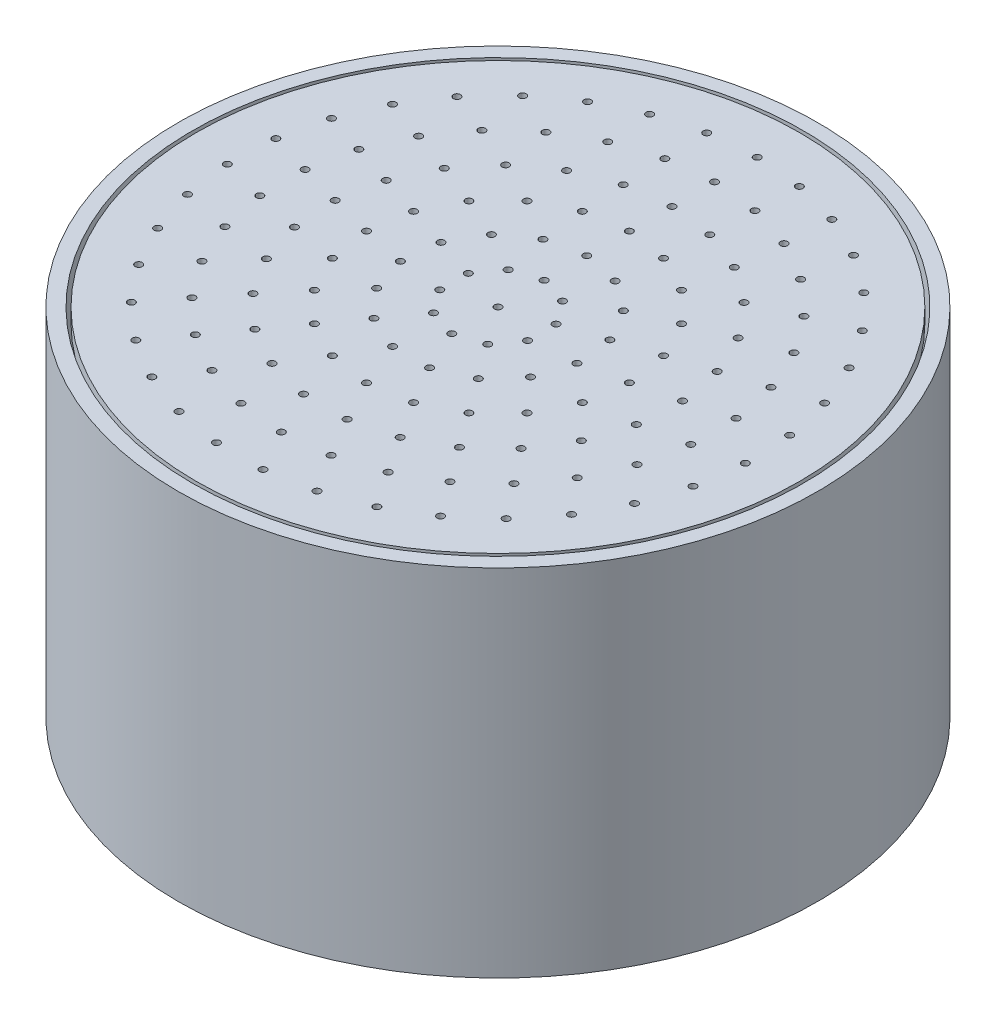
from build123d import *

# Parameters (mm, degrees)
SKETCH1_R            = 225
SKETCH1_R_2          = 215
BOSS_EXTRUDE1_DEPTH  = 250
SKETCH2_R            = 212.5
SKETCH2_R_2          = 2.5
BOSS_EXTRUDE13_DEPTH = 10
SKETCH4_R            = 212.5
SKETCH4_R_2          = 2.5
BOSS_EXTRUDE14_DEPTH = 10


with BuildPart() as part:
    # Sketch1 → Boss-Extrude1 (new body)
    with BuildSketch(Plane(origin=(0, 0, 0), x_dir=(1, 0, 0), z_dir=(0, 1, 0))):
        with Locations(Location((0, 0, 0), (0, 0, 270))):
            Circle(SKETCH1_R)
        with Locations(Location((0, 0, 0), (0, 0, 270))):
            Circle(SKETCH1_R_2, mode=Mode.SUBTRACT)
    extrude(amount=BOSS_EXTRUDE1_DEPTH)


with BuildPart() as body_2:
    # Sketch2 → Boss-Extrude13 (new body)
    with BuildSketch(Plane(origin=(0, 0, 0), x_dir=(1, 0, 0), z_dir=(0, 1, 0))):
        with Locations(Location((0, 0, 0), (0, 0, 270))):
            Circle(SKETCH2_R)
        with Locations(Location((0, 0, 0), (0, 0, 270))):
            Circle(SKETCH2_R_2, mode=Mode.SUBTRACT)
        with Locations(Location((0, 182.5, 0), (0, 0, 270))):
            Circle(SKETCH2_R_2, mode=Mode.SUBTRACT)
        with Locations(Location((32.586633301, 179.567149919, 0), (0, 0, 270))):
            Circle(SKETCH2_R_2, mode=Mode.SUBTRACT)
        with Locations(Location((64.125905395, 170.862863892, 0), (0, 0, 270))):
            Circle(SKETCH2_R_2, mode=Mode.SUBTRACT)
        with Locations(Location((93.604118127, 156.666904832, 0), (0, 0, 270))):
            Circle(SKETCH2_R_2, mode=Mode.SUBTRACT)
        with Locations(Location((120.073817484, 137.435542546, 0), (0, 0, 270))):
            Circle(SKETCH2_R_2, mode=Mode.SUBTRACT)
        with Locations(Location((142.68424555, 113.786888839, 0), (0, 0, 270))):
            Circle(SKETCH2_R_2, mode=Mode.SUBTRACT)
        with Locations(Location((160.708684564, 86.481030901, 0), (0, 0, 270))):
            Circle(SKETCH2_R_2, mode=Mode.SUBTRACT)
        with Locations(Location((173.567814224, 56.395601473, 0), (0, 0, 270))):
            Circle(SKETCH2_R_2, mode=Mode.SUBTRACT)
        with Locations(Location((180.848331523, 24.497571012, 0), (0, 0, 270))):
            Circle(SKETCH2_R_2, mode=Mode.SUBTRACT)
        with Locations(Location((182.316234644, -8.187831539, 0), (0, 0, 270))):
            Circle(SKETCH2_R_2, mode=Mode.SUBTRACT)
        with Locations(Location((177.924343973, -40.610070447, 0), (0, 0, 270))):
            Circle(SKETCH2_R_2, mode=Mode.SUBTRACT)
        with Locations(Location((167.813818491, -71.727068277, 0), (0, 0, 270))):
            Circle(SKETCH2_R_2, mode=Mode.SUBTRACT)
        with Locations(Location((152.309618804, -100.538699115, 0), (0, 0, 270))):
            Circle(SKETCH2_R_2, mode=Mode.SUBTRACT)
        with Locations(Location((131.910062649, -126.11893344, 0), (0, 0, 270))):
            Circle(SKETCH2_R_2, mode=Mode.SUBTRACT)
        with Locations(Location((107.270808543, -147.645601473, 0), (0, 0, 270))):
            Circle(SKETCH2_R_2, mode=Mode.SUBTRACT)
        with Locations(Location((79.183782389, -164.426818392, 0), (0, 0, 270))):
            Circle(SKETCH2_R_2, mode=Mode.SUBTRACT)
        with Locations(Location((48.551724316, -175.923222077, 0), (0, 0, 270))):
            Circle(SKETCH2_R_2, mode=Mode.SUBTRACT)
        with Locations(Location((16.359173875, -181.765308654, 0), (0, 0, 270))):
            Circle(SKETCH2_R_2, mode=Mode.SUBTRACT)
        with Locations(Location((-16.359173875, -181.765308654, 0), (0, 0, 270))):
            Circle(SKETCH2_R_2, mode=Mode.SUBTRACT)
        with Locations(Location((-48.551724316, -175.923222077, 0), (0, 0, 270))):
            Circle(SKETCH2_R_2, mode=Mode.SUBTRACT)
        with Locations(Location((-79.183782389, -164.426818392, 0), (0, 0, 270))):
            Circle(SKETCH2_R_2, mode=Mode.SUBTRACT)
        with Locations(Location((-107.270808543, -147.645601473, 0), (0, 0, 270))):
            Circle(SKETCH2_R_2, mode=Mode.SUBTRACT)
        with Locations(Location((-131.910062648, -126.11893344, 0), (0, 0, 270))):
            Circle(SKETCH2_R_2, mode=Mode.SUBTRACT)
        with Locations(Location((-152.309618804, -100.538699115, 0), (0, 0, 270))):
            Circle(SKETCH2_R_2, mode=Mode.SUBTRACT)
        with Locations(Location((-167.813818491, -71.727068277, 0), (0, 0, 270))):
            Circle(SKETCH2_R_2, mode=Mode.SUBTRACT)
        with Locations(Location((-177.924343973, -40.610070447, 0), (0, 0, 270))):
            Circle(SKETCH2_R_2, mode=Mode.SUBTRACT)
        with Locations(Location((-182.316234644, -8.187831539, 0), (0, 0, 270))):
            Circle(SKETCH2_R_2, mode=Mode.SUBTRACT)
        with Locations(Location((-180.848331523, 24.497571012, 0), (0, 0, 270))):
            Circle(SKETCH2_R_2, mode=Mode.SUBTRACT)
        with Locations(Location((-173.567814224, 56.395601473, 0), (0, 0, 270))):
            Circle(SKETCH2_R_2, mode=Mode.SUBTRACT)
        with Locations(Location((-160.708684564, 86.481030901, 0), (0, 0, 270))):
            Circle(SKETCH2_R_2, mode=Mode.SUBTRACT)
        with Locations(Location((0, 152.5, 0), (0, 0, 270))):
            Circle(SKETCH2_R_2, mode=Mode.SUBTRACT)
        with Locations(Location((0, 122.5, 0), (0, 0, 270))):
            Circle(SKETCH2_R_2, mode=Mode.SUBTRACT)
        with Locations(Location((0, 92.5, 0), (0, 0, 270))):
            Circle(SKETCH2_R_2, mode=Mode.SUBTRACT)
        with Locations(Location((0, 62.5, 0), (0, 0, 270))):
            Circle(SKETCH2_R_2, mode=Mode.SUBTRACT)
        with Locations(Location((0, 32.5, 0), (0, 0, 270))):
            Circle(SKETCH2_R_2, mode=Mode.SUBTRACT)
        with Locations(Location((31.70653285, 149.167509112, 0), (0, 0, 270))):
            Circle(SKETCH2_R_2, mode=Mode.SUBTRACT)
        with Locations(Location((62.027338069, 139.31568229, 0), (0, 0, 270))):
            Circle(SKETCH2_R_2, mode=Mode.SUBTRACT)
        with Locations(Location((89.637250975, 123.375091642, 0), (0, 0, 270))):
            Circle(SKETCH2_R_2, mode=Mode.SUBTRACT)
        with Locations(Location((113.329585885, 102.04241747, 0), (0, 0, 270))):
            Circle(SKETCH2_R_2, mode=Mode.SUBTRACT)
        with Locations(Location((132.068874077, 76.25, 0), (0, 0, 270))):
            Circle(SKETCH2_R_2, mode=Mode.SUBTRACT)
        with Locations(Location((145.036118735, 47.125091642, 0), (0, 0, 270))):
            Circle(SKETCH2_R_2, mode=Mode.SUBTRACT)
        with Locations(Location((151.664589044, 15.940590648, 0), (0, 0, 270))):
            Circle(SKETCH2_R_2, mode=Mode.SUBTRACT)
        with Locations(Location((151.664589044, -15.940590648, 0), (0, 0, 270))):
            Circle(SKETCH2_R_2, mode=Mode.SUBTRACT)
        with Locations(Location((145.036118735, -47.125091642, 0), (0, 0, 270))):
            Circle(SKETCH2_R_2, mode=Mode.SUBTRACT)
        with Locations(Location((132.068874077, -76.25, 0), (0, 0, 270))):
            Circle(SKETCH2_R_2, mode=Mode.SUBTRACT)
        with Locations(Location((113.329585885, -102.04241747, 0), (0, 0, 270))):
            Circle(SKETCH2_R_2, mode=Mode.SUBTRACT)
        with Locations(Location((89.637250975, -123.375091642, 0), (0, 0, 270))):
            Circle(SKETCH2_R_2, mode=Mode.SUBTRACT)
        with Locations(Location((62.027338069, -139.31568229, 0), (0, 0, 270))):
            Circle(SKETCH2_R_2, mode=Mode.SUBTRACT)
        with Locations(Location((31.70653285, -149.167509112, 0), (0, 0, 270))):
            Circle(SKETCH2_R_2, mode=Mode.SUBTRACT)
        with Locations(Location((0, -152.5, 0), (0, 0, 270))):
            Circle(SKETCH2_R_2, mode=Mode.SUBTRACT)
        with Locations(Location((-31.70653285, -149.167509112, 0), (0, 0, 270))):
            Circle(SKETCH2_R_2, mode=Mode.SUBTRACT)
        with Locations(Location((-62.027338069, -139.31568229, 0), (0, 0, 270))):
            Circle(SKETCH2_R_2, mode=Mode.SUBTRACT)
        with Locations(Location((-89.637250975, -123.375091642, 0), (0, 0, 270))):
            Circle(SKETCH2_R_2, mode=Mode.SUBTRACT)
        with Locations(Location((-113.329585885, -102.04241747, 0), (0, 0, 270))):
            Circle(SKETCH2_R_2, mode=Mode.SUBTRACT)
        with Locations(Location((-132.068874077, -76.25, 0), (0, 0, 270))):
            Circle(SKETCH2_R_2, mode=Mode.SUBTRACT)
        with Locations(Location((-145.036118735, -47.125091642, 0), (0, 0, 270))):
            Circle(SKETCH2_R_2, mode=Mode.SUBTRACT)
        with Locations(Location((-151.664589044, -15.940590648, 0), (0, 0, 270))):
            Circle(SKETCH2_R_2, mode=Mode.SUBTRACT)
        with Locations(Location((-151.664589044, 15.940590648, 0), (0, 0, 270))):
            Circle(SKETCH2_R_2, mode=Mode.SUBTRACT)
        with Locations(Location((-145.036118735, 47.125091642, 0), (0, 0, 270))):
            Circle(SKETCH2_R_2, mode=Mode.SUBTRACT)
        with Locations(Location((-132.068874077, 76.25, 0), (0, 0, 270))):
            Circle(SKETCH2_R_2, mode=Mode.SUBTRACT)
        with Locations(Location((-113.329585885, 102.04241747, 0), (0, 0, 270))):
            Circle(SKETCH2_R_2, mode=Mode.SUBTRACT)
        with Locations(Location((-89.637250975, 123.375091642, 0), (0, 0, 270))):
            Circle(SKETCH2_R_2, mode=Mode.SUBTRACT)
        with Locations(Location((-62.027338069, 139.31568229, 0), (0, 0, 270))):
            Circle(SKETCH2_R_2, mode=Mode.SUBTRACT)
        with Locations(Location((-31.70653285, 149.167509112, 0), (0, 0, 270))):
            Circle(SKETCH2_R_2, mode=Mode.SUBTRACT)
        with Locations(Location((30.464511178, 118.651437238, 0), (0, 0, 270))):
            Circle(SKETCH2_R_2, mode=Mode.SUBTRACT)
        with Locations(Location((59.014825077, 107.347568305, 0), (0, 0, 270))):
            Circle(SKETCH2_R_2, mode=Mode.SUBTRACT)
        with Locations(Location((83.857020476, 89.298656859, 0), (0, 0, 270))):
            Circle(SKETCH2_R_2, mode=Mode.SUBTRACT)
        with Locations(Location((103.430170874, 65.638782385, 0), (0, 0, 270))):
            Circle(SKETCH2_R_2, mode=Mode.SUBTRACT)
        with Locations(Location((116.504423246, 37.854581811, 0), (0, 0, 270))):
            Circle(SKETCH2_R_2, mode=Mode.SUBTRACT)
        with Locations(Location((122.258274232, 7.691838642, 0), (0, 0, 270))):
            Circle(SKETCH2_R_2, mode=Mode.SUBTRACT)
        with Locations(Location((120.330188214, -22.954211037, 0), (0, 0, 270))):
            Circle(SKETCH2_R_2, mode=Mode.SUBTRACT)
        with Locations(Location((110.841313927, -52.157963217, 0), (0, 0, 270))):
            Circle(SKETCH2_R_2, mode=Mode.SUBTRACT)
        with Locations(Location((94.38787224, -78.084438744, 0), (0, 0, 270))):
            Circle(SKETCH2_R_2, mode=Mode.SUBTRACT)
        with Locations(Location((72.003693406, -99.104581811, 0), (0, 0, 270))):
            Circle(SKETCH2_R_2, mode=Mode.SUBTRACT)
        with Locations(Location((45.095257704, -113.897619521, 0), (0, 0, 270))):
            Circle(SKETCH2_R_2, mode=Mode.SUBTRACT)
        with Locations(Location((15.353321112, -121.534050911, 0), (0, 0, 270))):
            Circle(SKETCH2_R_2, mode=Mode.SUBTRACT)
        with Locations(Location((-15.353321112, -121.534050911, 0), (0, 0, 270))):
            Circle(SKETCH2_R_2, mode=Mode.SUBTRACT)
        with Locations(Location((-45.095257704, -113.897619521, 0), (0, 0, 270))):
            Circle(SKETCH2_R_2, mode=Mode.SUBTRACT)
        with Locations(Location((-72.003693406, -99.104581811, 0), (0, 0, 270))):
            Circle(SKETCH2_R_2, mode=Mode.SUBTRACT)
        with Locations(Location((-94.38787224, -78.084438744, 0), (0, 0, 270))):
            Circle(SKETCH2_R_2, mode=Mode.SUBTRACT)
        with Locations(Location((-110.841313927, -52.157963217, 0), (0, 0, 270))):
            Circle(SKETCH2_R_2, mode=Mode.SUBTRACT)
        with Locations(Location((-120.330188214, -22.954211037, 0), (0, 0, 270))):
            Circle(SKETCH2_R_2, mode=Mode.SUBTRACT)
        with Locations(Location((-122.258274232, 7.691838642, 0), (0, 0, 270))):
            Circle(SKETCH2_R_2, mode=Mode.SUBTRACT)
        with Locations(Location((-116.504423246, 37.854581811, 0), (0, 0, 270))):
            Circle(SKETCH2_R_2, mode=Mode.SUBTRACT)
        with Locations(Location((-103.430170874, 65.638782385, 0), (0, 0, 270))):
            Circle(SKETCH2_R_2, mode=Mode.SUBTRACT)
        with Locations(Location((-83.857020476, 89.298656859, 0), (0, 0, 270))):
            Circle(SKETCH2_R_2, mode=Mode.SUBTRACT)
        with Locations(Location((-59.014825077, 107.347568305, 0), (0, 0, 270))):
            Circle(SKETCH2_R_2, mode=Mode.SUBTRACT)
        with Locations(Location((-30.464511178, 118.651437238, 0), (0, 0, 270))):
            Circle(SKETCH2_R_2, mode=Mode.SUBTRACT)
        with Locations(Location((28.58407198, 87.972727757, 0), (0, 0, 270))):
            Circle(SKETCH2_R_2, mode=Mode.SUBTRACT)
        with Locations(Location((54.370135837, 74.83407198, 0), (0, 0, 270))):
            Circle(SKETCH2_R_2, mode=Mode.SUBTRACT)
        with Locations(Location((74.83407198, 54.370135837, 0), (0, 0, 270))):
            Circle(SKETCH2_R_2, mode=Mode.SUBTRACT)
        with Locations(Location((87.972727757, 28.58407198, 0), (0, 0, 270))):
            Circle(SKETCH2_R_2, mode=Mode.SUBTRACT)
        with Locations(Location((92.5, 0, 0), (0, 0, 270))):
            Circle(SKETCH2_R_2, mode=Mode.SUBTRACT)
        with Locations(Location((87.972727757, -28.58407198, 0), (0, 0, 270))):
            Circle(SKETCH2_R_2, mode=Mode.SUBTRACT)
        with Locations(Location((74.83407198, -54.370135837, 0), (0, 0, 270))):
            Circle(SKETCH2_R_2, mode=Mode.SUBTRACT)
        with Locations(Location((54.370135837, -74.83407198, 0), (0, 0, 270))):
            Circle(SKETCH2_R_2, mode=Mode.SUBTRACT)
        with Locations(Location((28.58407198, -87.972727757, 0), (0, 0, 270))):
            Circle(SKETCH2_R_2, mode=Mode.SUBTRACT)
        with Locations(Location((0, -92.5, 0), (0, 0, 270))):
            Circle(SKETCH2_R_2, mode=Mode.SUBTRACT)
        with Locations(Location((-28.58407198, -87.972727757, 0), (0, 0, 270))):
            Circle(SKETCH2_R_2, mode=Mode.SUBTRACT)
        with Locations(Location((-54.370135837, -74.83407198, 0), (0, 0, 270))):
            Circle(SKETCH2_R_2, mode=Mode.SUBTRACT)
        with Locations(Location((-74.83407198, -54.370135837, 0), (0, 0, 270))):
            Circle(SKETCH2_R_2, mode=Mode.SUBTRACT)
        with Locations(Location((-87.972727757, -28.58407198, 0), (0, 0, 270))):
            Circle(SKETCH2_R_2, mode=Mode.SUBTRACT)
        with Locations(Location((-92.5, 0, 0), (0, 0, 270))):
            Circle(SKETCH2_R_2, mode=Mode.SUBTRACT)
        with Locations(Location((-87.972727757, 28.58407198, 0), (0, 0, 270))):
            Circle(SKETCH2_R_2, mode=Mode.SUBTRACT)
        with Locations(Location((-74.83407198, 54.370135837, 0), (0, 0, 270))):
            Circle(SKETCH2_R_2, mode=Mode.SUBTRACT)
        with Locations(Location((-54.370135837, 74.83407198, 0), (0, 0, 270))):
            Circle(SKETCH2_R_2, mode=Mode.SUBTRACT)
        with Locations(Location((-28.58407198, 87.972727757, 0), (0, 0, 270))):
            Circle(SKETCH2_R_2, mode=Mode.SUBTRACT)
        with Locations(Location((-142.68424555, 113.786888839, 0), (0, 0, 270))):
            Circle(SKETCH2_R_2, mode=Mode.SUBTRACT)
        with Locations(Location((-120.073817484, 137.435542546, 0), (0, 0, 270))):
            Circle(SKETCH2_R_2, mode=Mode.SUBTRACT)
        with Locations(Location((-93.604118127, 156.666904832, 0), (0, 0, 270))):
            Circle(SKETCH2_R_2, mode=Mode.SUBTRACT)
        with Locations(Location((-64.125905395, 170.862863892, 0), (0, 0, 270))):
            Circle(SKETCH2_R_2, mode=Mode.SUBTRACT)
        with Locations(Location((-32.586633301, 179.567149919, 0), (0, 0, 270))):
            Circle(SKETCH2_R_2, mode=Mode.SUBTRACT)
        with Locations(Location((25.421040192, 57.096591103, 0), (0, 0, 270))):
            Circle(SKETCH2_R_2, mode=Mode.SUBTRACT)
        with Locations(Location((46.446551592, 41.820662897, 0), (0, 0, 270))):
            Circle(SKETCH2_R_2, mode=Mode.SUBTRACT)
        with Locations(Location((59.441032268, 19.313562148, 0), (0, 0, 270))):
            Circle(SKETCH2_R_2, mode=Mode.SUBTRACT)
        with Locations(Location((62.157618461, -6.533028954, 0), (0, 0, 270))):
            Circle(SKETCH2_R_2, mode=Mode.SUBTRACT)
        with Locations(Location((54.126587737, -31.25, 0), (0, 0, 270))):
            Circle(SKETCH2_R_2, mode=Mode.SUBTRACT)
        with Locations(Location((36.736578268, -50.563562148, 0), (0, 0, 270))):
            Circle(SKETCH2_R_2, mode=Mode.SUBTRACT)
        with Locations(Location((12.994480676, -61.134225046, 0), (0, 0, 270))):
            Circle(SKETCH2_R_2, mode=Mode.SUBTRACT)
        with Locations(Location((-12.994480676, -61.134225046, 0), (0, 0, 270))):
            Circle(SKETCH2_R_2, mode=Mode.SUBTRACT)
        with Locations(Location((-36.736578268, -50.563562148, 0), (0, 0, 270))):
            Circle(SKETCH2_R_2, mode=Mode.SUBTRACT)
        with Locations(Location((-54.126587737, -31.25, 0), (0, 0, 270))):
            Circle(SKETCH2_R_2, mode=Mode.SUBTRACT)
        with Locations(Location((-62.157618461, -6.533028954, 0), (0, 0, 270))):
            Circle(SKETCH2_R_2, mode=Mode.SUBTRACT)
        with Locations(Location((-59.441032268, 19.313562148, 0), (0, 0, 270))):
            Circle(SKETCH2_R_2, mode=Mode.SUBTRACT)
        with Locations(Location((-46.446551592, 41.820662897, 0), (0, 0, 270))):
            Circle(SKETCH2_R_2, mode=Mode.SUBTRACT)
        with Locations(Location((-25.421040192, 57.096591103, 0), (0, 0, 270))):
            Circle(SKETCH2_R_2, mode=Mode.SUBTRACT)
        with Locations(Location((19.1030207, 26.293052317, 0), (0, 0, 270))):
            Circle(SKETCH2_R_2, mode=Mode.SUBTRACT)
        with Locations(Location((30.90933678, 10.043052317, 0), (0, 0, 270))):
            Circle(SKETCH2_R_2, mode=Mode.SUBTRACT)
        with Locations(Location((30.90933678, -10.043052317, 0), (0, 0, 270))):
            Circle(SKETCH2_R_2, mode=Mode.SUBTRACT)
        with Locations(Location((19.1030207, -26.293052317, 0), (0, 0, 270))):
            Circle(SKETCH2_R_2, mode=Mode.SUBTRACT)
        with Locations(Location((0, -32.5, 0), (0, 0, 270))):
            Circle(SKETCH2_R_2, mode=Mode.SUBTRACT)
        with Locations(Location((-19.1030207, -26.293052317, 0), (0, 0, 270))):
            Circle(SKETCH2_R_2, mode=Mode.SUBTRACT)
        with Locations(Location((-30.90933678, -10.043052317, 0), (0, 0, 270))):
            Circle(SKETCH2_R_2, mode=Mode.SUBTRACT)
        with Locations(Location((-30.90933678, 10.043052317, 0), (0, 0, 270))):
            Circle(SKETCH2_R_2, mode=Mode.SUBTRACT)
        with Locations(Location((-19.1030207, 26.293052317, 0), (0, 0, 270))):
            Circle(SKETCH2_R_2, mode=Mode.SUBTRACT)
    extrude(amount=BOSS_EXTRUDE13_DEPTH)


with BuildPart() as body_3:
    # Sketch4 → Boss-Extrude14 (new body)
    with BuildSketch(Plane(origin=(0, 250, 0), x_dir=(1, 0, 0), z_dir=(0, 1, 0))):
        with Locations(Location((0, 0, 0), (0, 0, 270))):
            Circle(SKETCH4_R)
        with Locations(Location((0, 0, 0), (0, 0, 270))):
            Circle(SKETCH4_R_2, mode=Mode.SUBTRACT)
        with Locations(Location((0, 182.5, 0), (0, 0, 270))):
            Circle(SKETCH4_R_2, mode=Mode.SUBTRACT)
        with Locations(Location((32.586633301, 179.567149919, 0), (0, 0, 270))):
            Circle(SKETCH4_R_2, mode=Mode.SUBTRACT)
        with Locations(Location((64.125905395, 170.862863892, 0), (0, 0, 270))):
            Circle(SKETCH4_R_2, mode=Mode.SUBTRACT)
        with Locations(Location((93.604118127, 156.666904832, 0), (0, 0, 270))):
            Circle(SKETCH4_R_2, mode=Mode.SUBTRACT)
        with Locations(Location((120.073817484, 137.435542546, 0), (0, 0, 270))):
            Circle(SKETCH4_R_2, mode=Mode.SUBTRACT)
        with Locations(Location((142.68424555, 113.786888839, 0), (0, 0, 270))):
            Circle(SKETCH4_R_2, mode=Mode.SUBTRACT)
        with Locations(Location((160.708684564, 86.481030901, 0), (0, 0, 270))):
            Circle(SKETCH4_R_2, mode=Mode.SUBTRACT)
        with Locations(Location((173.567814224, 56.395601473, 0), (0, 0, 270))):
            Circle(SKETCH4_R_2, mode=Mode.SUBTRACT)
        with Locations(Location((180.848331523, 24.497571012, 0), (0, 0, 270))):
            Circle(SKETCH4_R_2, mode=Mode.SUBTRACT)
        with Locations(Location((182.316234644, -8.187831539, 0), (0, 0, 270))):
            Circle(SKETCH4_R_2, mode=Mode.SUBTRACT)
        with Locations(Location((177.924343973, -40.610070447, 0), (0, 0, 270))):
            Circle(SKETCH4_R_2, mode=Mode.SUBTRACT)
        with Locations(Location((167.813818491, -71.727068277, 0), (0, 0, 270))):
            Circle(SKETCH4_R_2, mode=Mode.SUBTRACT)
        with Locations(Location((152.309618804, -100.538699115, 0), (0, 0, 270))):
            Circle(SKETCH4_R_2, mode=Mode.SUBTRACT)
        with Locations(Location((131.910062649, -126.11893344, 0), (0, 0, 270))):
            Circle(SKETCH4_R_2, mode=Mode.SUBTRACT)
        with Locations(Location((107.270808543, -147.645601473, 0), (0, 0, 270))):
            Circle(SKETCH4_R_2, mode=Mode.SUBTRACT)
        with Locations(Location((79.183782389, -164.426818392, 0), (0, 0, 270))):
            Circle(SKETCH4_R_2, mode=Mode.SUBTRACT)
        with Locations(Location((48.551724316, -175.923222077, 0), (0, 0, 270))):
            Circle(SKETCH4_R_2, mode=Mode.SUBTRACT)
        with Locations(Location((16.359173875, -181.765308654, 0), (0, 0, 270))):
            Circle(SKETCH4_R_2, mode=Mode.SUBTRACT)
        with Locations(Location((-16.359173875, -181.765308654, 0), (0, 0, 270))):
            Circle(SKETCH4_R_2, mode=Mode.SUBTRACT)
        with Locations(Location((-48.551724316, -175.923222077, 0), (0, 0, 270))):
            Circle(SKETCH4_R_2, mode=Mode.SUBTRACT)
        with Locations(Location((-79.183782389, -164.426818392, 0), (0, 0, 270))):
            Circle(SKETCH4_R_2, mode=Mode.SUBTRACT)
        with Locations(Location((-107.270808543, -147.645601473, 0), (0, 0, 270))):
            Circle(SKETCH4_R_2, mode=Mode.SUBTRACT)
        with Locations(Location((-131.910062648, -126.11893344, 0), (0, 0, 270))):
            Circle(SKETCH4_R_2, mode=Mode.SUBTRACT)
        with Locations(Location((-152.309618804, -100.538699115, 0), (0, 0, 270))):
            Circle(SKETCH4_R_2, mode=Mode.SUBTRACT)
        with Locations(Location((-167.813818491, -71.727068277, 0), (0, 0, 270))):
            Circle(SKETCH4_R_2, mode=Mode.SUBTRACT)
        with Locations(Location((-177.924343973, -40.610070447, 0), (0, 0, 270))):
            Circle(SKETCH4_R_2, mode=Mode.SUBTRACT)
        with Locations(Location((-182.316234644, -8.187831539, 0), (0, 0, 270))):
            Circle(SKETCH4_R_2, mode=Mode.SUBTRACT)
        with Locations(Location((-180.848331523, 24.497571012, 0), (0, 0, 270))):
            Circle(SKETCH4_R_2, mode=Mode.SUBTRACT)
        with Locations(Location((-173.567814224, 56.395601473, 0), (0, 0, 270))):
            Circle(SKETCH4_R_2, mode=Mode.SUBTRACT)
        with Locations(Location((-160.708684564, 86.481030901, 0), (0, 0, 270))):
            Circle(SKETCH4_R_2, mode=Mode.SUBTRACT)
        with Locations(Location((0, 152.5, 0), (0, 0, 270))):
            Circle(SKETCH4_R_2, mode=Mode.SUBTRACT)
        with Locations(Location((0, 122.5, 0), (0, 0, 270))):
            Circle(SKETCH4_R_2, mode=Mode.SUBTRACT)
        with Locations(Location((0, 92.5, 0), (0, 0, 270))):
            Circle(SKETCH4_R_2, mode=Mode.SUBTRACT)
        with Locations(Location((0, 62.5, 0), (0, 0, 270))):
            Circle(SKETCH4_R_2, mode=Mode.SUBTRACT)
        with Locations(Location((0, 32.5, 0), (0, 0, 270))):
            Circle(SKETCH4_R_2, mode=Mode.SUBTRACT)
        with Locations(Location((31.70653285, 149.167509112, 0), (0, 0, 270))):
            Circle(SKETCH4_R_2, mode=Mode.SUBTRACT)
        with Locations(Location((62.027338069, 139.31568229, 0), (0, 0, 270))):
            Circle(SKETCH4_R_2, mode=Mode.SUBTRACT)
        with Locations(Location((89.637250975, 123.375091642, 0), (0, 0, 270))):
            Circle(SKETCH4_R_2, mode=Mode.SUBTRACT)
        with Locations(Location((113.329585885, 102.04241747, 0), (0, 0, 270))):
            Circle(SKETCH4_R_2, mode=Mode.SUBTRACT)
        with Locations(Location((132.068874077, 76.25, 0), (0, 0, 270))):
            Circle(SKETCH4_R_2, mode=Mode.SUBTRACT)
        with Locations(Location((145.036118735, 47.125091642, 0), (0, 0, 270))):
            Circle(SKETCH4_R_2, mode=Mode.SUBTRACT)
        with Locations(Location((151.664589044, 15.940590648, 0), (0, 0, 270))):
            Circle(SKETCH4_R_2, mode=Mode.SUBTRACT)
        with Locations(Location((151.664589044, -15.940590648, 0), (0, 0, 270))):
            Circle(SKETCH4_R_2, mode=Mode.SUBTRACT)
        with Locations(Location((145.036118735, -47.125091642, 0), (0, 0, 270))):
            Circle(SKETCH4_R_2, mode=Mode.SUBTRACT)
        with Locations(Location((132.068874077, -76.25, 0), (0, 0, 270))):
            Circle(SKETCH4_R_2, mode=Mode.SUBTRACT)
        with Locations(Location((113.329585885, -102.04241747, 0), (0, 0, 270))):
            Circle(SKETCH4_R_2, mode=Mode.SUBTRACT)
        with Locations(Location((89.637250975, -123.375091642, 0), (0, 0, 270))):
            Circle(SKETCH4_R_2, mode=Mode.SUBTRACT)
        with Locations(Location((62.027338069, -139.31568229, 0), (0, 0, 270))):
            Circle(SKETCH4_R_2, mode=Mode.SUBTRACT)
        with Locations(Location((31.70653285, -149.167509112, 0), (0, 0, 270))):
            Circle(SKETCH4_R_2, mode=Mode.SUBTRACT)
        with Locations(Location((0, -152.5, 0), (0, 0, 270))):
            Circle(SKETCH4_R_2, mode=Mode.SUBTRACT)
        with Locations(Location((-31.70653285, -149.167509112, 0), (0, 0, 270))):
            Circle(SKETCH4_R_2, mode=Mode.SUBTRACT)
        with Locations(Location((-62.027338069, -139.31568229, 0), (0, 0, 270))):
            Circle(SKETCH4_R_2, mode=Mode.SUBTRACT)
        with Locations(Location((-89.637250975, -123.375091642, 0), (0, 0, 270))):
            Circle(SKETCH4_R_2, mode=Mode.SUBTRACT)
        with Locations(Location((-113.329585885, -102.04241747, 0), (0, 0, 270))):
            Circle(SKETCH4_R_2, mode=Mode.SUBTRACT)
        with Locations(Location((-132.068874077, -76.25, 0), (0, 0, 270))):
            Circle(SKETCH4_R_2, mode=Mode.SUBTRACT)
        with Locations(Location((-145.036118735, -47.125091642, 0), (0, 0, 270))):
            Circle(SKETCH4_R_2, mode=Mode.SUBTRACT)
        with Locations(Location((-151.664589044, -15.940590648, 0), (0, 0, 270))):
            Circle(SKETCH4_R_2, mode=Mode.SUBTRACT)
        with Locations(Location((-151.664589044, 15.940590648, 0), (0, 0, 270))):
            Circle(SKETCH4_R_2, mode=Mode.SUBTRACT)
        with Locations(Location((-145.036118735, 47.125091642, 0), (0, 0, 270))):
            Circle(SKETCH4_R_2, mode=Mode.SUBTRACT)
        with Locations(Location((-132.068874077, 76.25, 0), (0, 0, 270))):
            Circle(SKETCH4_R_2, mode=Mode.SUBTRACT)
        with Locations(Location((-113.329585885, 102.04241747, 0), (0, 0, 270))):
            Circle(SKETCH4_R_2, mode=Mode.SUBTRACT)
        with Locations(Location((-89.637250975, 123.375091642, 0), (0, 0, 270))):
            Circle(SKETCH4_R_2, mode=Mode.SUBTRACT)
        with Locations(Location((-62.027338069, 139.31568229, 0), (0, 0, 270))):
            Circle(SKETCH4_R_2, mode=Mode.SUBTRACT)
        with Locations(Location((-31.70653285, 149.167509112, 0), (0, 0, 270))):
            Circle(SKETCH4_R_2, mode=Mode.SUBTRACT)
        with Locations(Location((30.464511178, 118.651437238, 0), (0, 0, 270))):
            Circle(SKETCH4_R_2, mode=Mode.SUBTRACT)
        with Locations(Location((59.014825077, 107.347568305, 0), (0, 0, 270))):
            Circle(SKETCH4_R_2, mode=Mode.SUBTRACT)
        with Locations(Location((83.857020476, 89.298656859, 0), (0, 0, 270))):
            Circle(SKETCH4_R_2, mode=Mode.SUBTRACT)
        with Locations(Location((103.430170874, 65.638782385, 0), (0, 0, 270))):
            Circle(SKETCH4_R_2, mode=Mode.SUBTRACT)
        with Locations(Location((116.504423246, 37.854581811, 0), (0, 0, 270))):
            Circle(SKETCH4_R_2, mode=Mode.SUBTRACT)
        with Locations(Location((122.258274232, 7.691838642, 0), (0, 0, 270))):
            Circle(SKETCH4_R_2, mode=Mode.SUBTRACT)
        with Locations(Location((120.330188214, -22.954211037, 0), (0, 0, 270))):
            Circle(SKETCH4_R_2, mode=Mode.SUBTRACT)
        with Locations(Location((110.841313927, -52.157963217, 0), (0, 0, 270))):
            Circle(SKETCH4_R_2, mode=Mode.SUBTRACT)
        with Locations(Location((94.38787224, -78.084438744, 0), (0, 0, 270))):
            Circle(SKETCH4_R_2, mode=Mode.SUBTRACT)
        with Locations(Location((72.003693406, -99.104581811, 0), (0, 0, 270))):
            Circle(SKETCH4_R_2, mode=Mode.SUBTRACT)
        with Locations(Location((45.095257704, -113.897619521, 0), (0, 0, 270))):
            Circle(SKETCH4_R_2, mode=Mode.SUBTRACT)
        with Locations(Location((15.353321112, -121.534050911, 0), (0, 0, 270))):
            Circle(SKETCH4_R_2, mode=Mode.SUBTRACT)
        with Locations(Location((-15.353321112, -121.534050911, 0), (0, 0, 270))):
            Circle(SKETCH4_R_2, mode=Mode.SUBTRACT)
        with Locations(Location((-45.095257704, -113.897619521, 0), (0, 0, 270))):
            Circle(SKETCH4_R_2, mode=Mode.SUBTRACT)
        with Locations(Location((-72.003693406, -99.104581811, 0), (0, 0, 270))):
            Circle(SKETCH4_R_2, mode=Mode.SUBTRACT)
        with Locations(Location((-94.38787224, -78.084438744, 0), (0, 0, 270))):
            Circle(SKETCH4_R_2, mode=Mode.SUBTRACT)
        with Locations(Location((-110.841313927, -52.157963217, 0), (0, 0, 270))):
            Circle(SKETCH4_R_2, mode=Mode.SUBTRACT)
        with Locations(Location((-120.330188214, -22.954211037, 0), (0, 0, 270))):
            Circle(SKETCH4_R_2, mode=Mode.SUBTRACT)
        with Locations(Location((-122.258274232, 7.691838642, 0), (0, 0, 270))):
            Circle(SKETCH4_R_2, mode=Mode.SUBTRACT)
        with Locations(Location((-116.504423246, 37.854581811, 0), (0, 0, 270))):
            Circle(SKETCH4_R_2, mode=Mode.SUBTRACT)
        with Locations(Location((-103.430170874, 65.638782385, 0), (0, 0, 270))):
            Circle(SKETCH4_R_2, mode=Mode.SUBTRACT)
        with Locations(Location((-83.857020476, 89.298656859, 0), (0, 0, 270))):
            Circle(SKETCH4_R_2, mode=Mode.SUBTRACT)
        with Locations(Location((-59.014825077, 107.347568305, 0), (0, 0, 270))):
            Circle(SKETCH4_R_2, mode=Mode.SUBTRACT)
        with Locations(Location((-30.464511178, 118.651437238, 0), (0, 0, 270))):
            Circle(SKETCH4_R_2, mode=Mode.SUBTRACT)
        with Locations(Location((28.58407198, 87.972727757, 0), (0, 0, 270))):
            Circle(SKETCH4_R_2, mode=Mode.SUBTRACT)
        with Locations(Location((54.370135837, 74.83407198, 0), (0, 0, 270))):
            Circle(SKETCH4_R_2, mode=Mode.SUBTRACT)
        with Locations(Location((74.83407198, 54.370135837, 0), (0, 0, 270))):
            Circle(SKETCH4_R_2, mode=Mode.SUBTRACT)
        with Locations(Location((87.972727757, 28.58407198, 0), (0, 0, 270))):
            Circle(SKETCH4_R_2, mode=Mode.SUBTRACT)
        with Locations(Location((92.5, 0, 0), (0, 0, 270))):
            Circle(SKETCH4_R_2, mode=Mode.SUBTRACT)
        with Locations(Location((87.972727757, -28.58407198, 0), (0, 0, 270))):
            Circle(SKETCH4_R_2, mode=Mode.SUBTRACT)
        with Locations(Location((74.83407198, -54.370135837, 0), (0, 0, 270))):
            Circle(SKETCH4_R_2, mode=Mode.SUBTRACT)
        with Locations(Location((54.370135837, -74.83407198, 0), (0, 0, 270))):
            Circle(SKETCH4_R_2, mode=Mode.SUBTRACT)
        with Locations(Location((28.58407198, -87.972727757, 0), (0, 0, 270))):
            Circle(SKETCH4_R_2, mode=Mode.SUBTRACT)
        with Locations(Location((0, -92.5, 0), (0, 0, 270))):
            Circle(SKETCH4_R_2, mode=Mode.SUBTRACT)
        with Locations(Location((-28.58407198, -87.972727757, 0), (0, 0, 270))):
            Circle(SKETCH4_R_2, mode=Mode.SUBTRACT)
        with Locations(Location((-54.370135837, -74.83407198, 0), (0, 0, 270))):
            Circle(SKETCH4_R_2, mode=Mode.SUBTRACT)
        with Locations(Location((-74.83407198, -54.370135837, 0), (0, 0, 270))):
            Circle(SKETCH4_R_2, mode=Mode.SUBTRACT)
        with Locations(Location((-87.972727757, -28.58407198, 0), (0, 0, 270))):
            Circle(SKETCH4_R_2, mode=Mode.SUBTRACT)
        with Locations(Location((-92.5, 0, 0), (0, 0, 270))):
            Circle(SKETCH4_R_2, mode=Mode.SUBTRACT)
        with Locations(Location((-87.972727757, 28.58407198, 0), (0, 0, 270))):
            Circle(SKETCH4_R_2, mode=Mode.SUBTRACT)
        with Locations(Location((-74.83407198, 54.370135837, 0), (0, 0, 270))):
            Circle(SKETCH4_R_2, mode=Mode.SUBTRACT)
        with Locations(Location((-54.370135837, 74.83407198, 0), (0, 0, 270))):
            Circle(SKETCH4_R_2, mode=Mode.SUBTRACT)
        with Locations(Location((-28.58407198, 87.972727757, 0), (0, 0, 270))):
            Circle(SKETCH4_R_2, mode=Mode.SUBTRACT)
        with Locations(Location((-142.68424555, 113.786888839, 0), (0, 0, 270))):
            Circle(SKETCH4_R_2, mode=Mode.SUBTRACT)
        with Locations(Location((-120.073817484, 137.435542546, 0), (0, 0, 270))):
            Circle(SKETCH4_R_2, mode=Mode.SUBTRACT)
        with Locations(Location((-93.604118127, 156.666904832, 0), (0, 0, 270))):
            Circle(SKETCH4_R_2, mode=Mode.SUBTRACT)
        with Locations(Location((-64.125905395, 170.862863892, 0), (0, 0, 270))):
            Circle(SKETCH4_R_2, mode=Mode.SUBTRACT)
        with Locations(Location((-32.586633301, 179.567149919, 0), (0, 0, 270))):
            Circle(SKETCH4_R_2, mode=Mode.SUBTRACT)
        with Locations(Location((25.421040192, 57.096591103, 0), (0, 0, 270))):
            Circle(SKETCH4_R_2, mode=Mode.SUBTRACT)
        with Locations(Location((46.446551592, 41.820662897, 0), (0, 0, 270))):
            Circle(SKETCH4_R_2, mode=Mode.SUBTRACT)
        with Locations(Location((59.441032268, 19.313562148, 0), (0, 0, 270))):
            Circle(SKETCH4_R_2, mode=Mode.SUBTRACT)
        with Locations(Location((62.157618461, -6.533028954, 0), (0, 0, 270))):
            Circle(SKETCH4_R_2, mode=Mode.SUBTRACT)
        with Locations(Location((54.126587737, -31.25, 0), (0, 0, 270))):
            Circle(SKETCH4_R_2, mode=Mode.SUBTRACT)
        with Locations(Location((36.736578268, -50.563562148, 0), (0, 0, 270))):
            Circle(SKETCH4_R_2, mode=Mode.SUBTRACT)
        with Locations(Location((12.994480676, -61.134225046, 0), (0, 0, 270))):
            Circle(SKETCH4_R_2, mode=Mode.SUBTRACT)
        with Locations(Location((-12.994480676, -61.134225046, 0), (0, 0, 270))):
            Circle(SKETCH4_R_2, mode=Mode.SUBTRACT)
        with Locations(Location((-36.736578268, -50.563562148, 0), (0, 0, 270))):
            Circle(SKETCH4_R_2, mode=Mode.SUBTRACT)
        with Locations(Location((-54.126587737, -31.25, 0), (0, 0, 270))):
            Circle(SKETCH4_R_2, mode=Mode.SUBTRACT)
        with Locations(Location((-62.157618461, -6.533028954, 0), (0, 0, 270))):
            Circle(SKETCH4_R_2, mode=Mode.SUBTRACT)
        with Locations(Location((-59.441032268, 19.313562148, 0), (0, 0, 270))):
            Circle(SKETCH4_R_2, mode=Mode.SUBTRACT)
        with Locations(Location((-46.446551592, 41.820662897, 0), (0, 0, 270))):
            Circle(SKETCH4_R_2, mode=Mode.SUBTRACT)
        with Locations(Location((-25.421040192, 57.096591103, 0), (0, 0, 270))):
            Circle(SKETCH4_R_2, mode=Mode.SUBTRACT)
        with Locations(Location((19.1030207, 26.293052317, 0), (0, 0, 270))):
            Circle(SKETCH4_R_2, mode=Mode.SUBTRACT)
        with Locations(Location((30.90933678, 10.043052317, 0), (0, 0, 270))):
            Circle(SKETCH4_R_2, mode=Mode.SUBTRACT)
        with Locations(Location((30.90933678, -10.043052317, 0), (0, 0, 270))):
            Circle(SKETCH4_R_2, mode=Mode.SUBTRACT)
        with Locations(Location((19.1030207, -26.293052317, 0), (0, 0, 270))):
            Circle(SKETCH4_R_2, mode=Mode.SUBTRACT)
        with Locations(Location((0, -32.5, 0), (0, 0, 270))):
            Circle(SKETCH4_R_2, mode=Mode.SUBTRACT)
        with Locations(Location((-19.1030207, -26.293052317, 0), (0, 0, 270))):
            Circle(SKETCH4_R_2, mode=Mode.SUBTRACT)
        with Locations(Location((-30.90933678, -10.043052317, 0), (0, 0, 270))):
            Circle(SKETCH4_R_2, mode=Mode.SUBTRACT)
        with Locations(Location((-30.90933678, 10.043052317, 0), (0, 0, 270))):
            Circle(SKETCH4_R_2, mode=Mode.SUBTRACT)
        with Locations(Location((-19.1030207, 26.293052317, 0), (0, 0, 270))):
            Circle(SKETCH4_R_2, mode=Mode.SUBTRACT)
    extrude(amount=-BOSS_EXTRUDE14_DEPTH)


solid = Compound([part.part, body_2.part, body_3.part])
